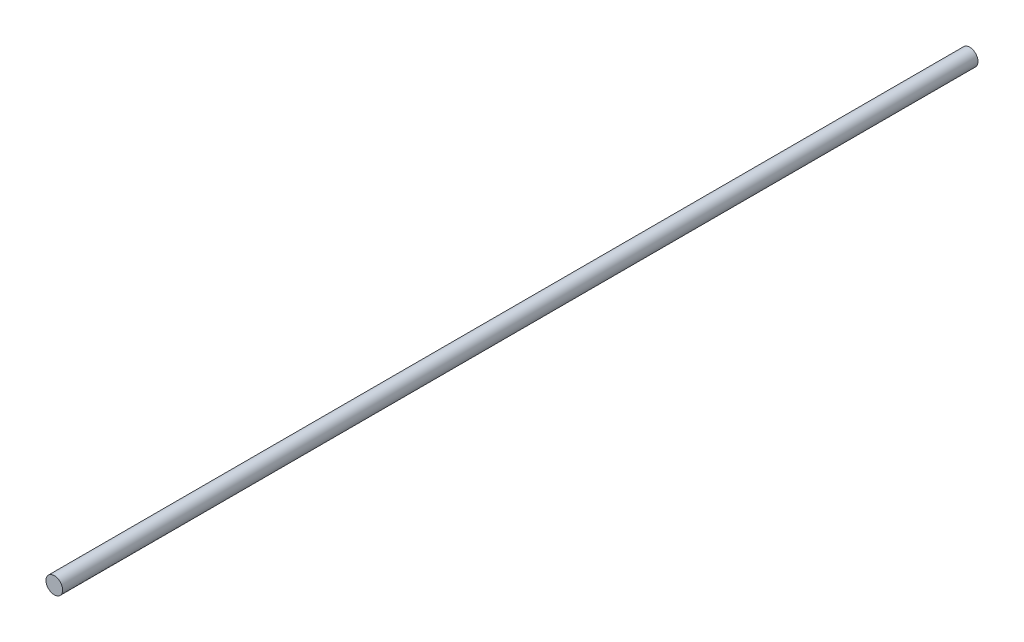
from build123d import *

# Parameters (mm, degrees)
SKETCH1_R           = 5
BOSS_EXTRUDE2_DEPTH = 550


with BuildPart() as part:
    # Sketch1 → Boss-Extrude2 (new body)
    with BuildSketch(Plane.XY):
        Circle(SKETCH1_R)
    extrude(amount=BOSS_EXTRUDE2_DEPTH)


solid = part.part
